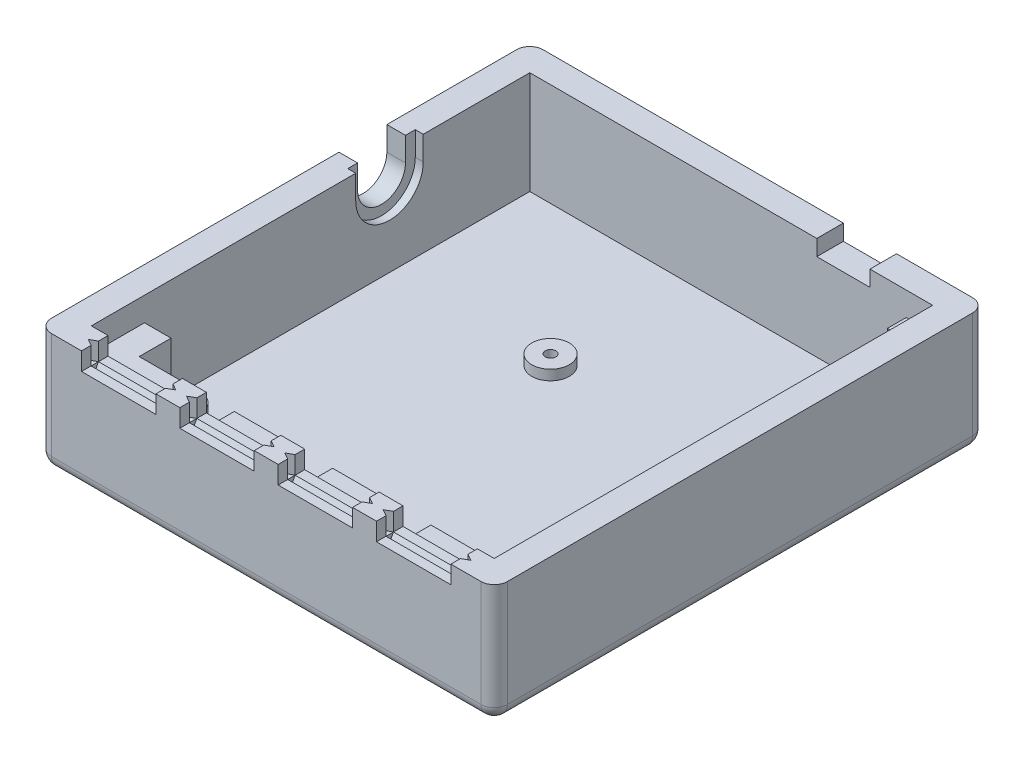
from build123d import *

# Parameters (mm, degrees)
SKETCH1_W           = 85.8
SKETCH1_H           = 92.5
BOSS_EXTRUDE1_DEPTH = 14.859
SKETCH2_W           = 85.8
SKETCH2_H           = 92.5
SKETCH2_R           = 1
BOSS_EXTRUDE2_DEPTH = 3.175
SKETCH4_W           = 85.8
SKETCH4_H           = 92.5
SKETCH4_W_2         = 75.8
SKETCH4_H_2         = 82.5
BOSS_EXTRUDE3_DEPTH = 4.5
CUT_EXTRUDE1_DEPTH  = 121.663419813
SKETCH5_W           = 14
SKETCH5_H           = 8
CUT_EXTRUDE2_DEPTH  = 121.663419813
SKETCH6_W           = 10
SKETCH6_H           = 6
CUT_EXTRUDE3_DEPTH  = 121.663419813
BOSS_EXTRUDE4_START = 1.9
SKETCH7_R           = 3.54
SKETCH7_R_2         = 1
BOSS_EXTRUDE4_DEPTH = 1.9
FILLET1_R           = 2.5
FILLET2_R           = 2.5
FILLET3_R           = 2.5
FILLET4_R           = 2.5
FILLET5_R           = 2.5
CUT_EXTRUDE4_DEPTH  = 1.5
CUT_EXTRUDE5_DEPTH  = 4
CUT_EXTRUDE7_DEPTH  = 73.9
SKETCH12_W          = 4.501
SKETCH12_H          = 4
BOSS_EXTRUDE8_DEPTH = 5


with BuildPart() as part:
    # Sketch1 → Boss-Extrude1 (new body)
    with BuildSketch(Plane(origin=(0, 0, 0), x_dir=(1, 0, 0), z_dir=(0, 1, 0))):
        with Locations((37.9, 41.25)):
            Rectangle(SKETCH1_W, SKETCH1_H)
        Polygon((5, 4), (5, 10), (0, 10), (0, 82.5), (70.8, 82.5), (70.8, 79), (75.8, 79), (75.8, 4), (59.9, 4), (59.9, 0), (52.9, 0), (52.9, 4), (41.4, 4), (41.4, 0), (34.4, 0), (34.4, 4), (22.9, 4), (22.9, 0), (15.9, 0), (15.9, 4), align=None, mode=Mode.SUBTRACT)
    extrude(amount=BOSS_EXTRUDE1_DEPTH)

    # Sketch2 → Boss-Extrude2 (add)
    with BuildSketch(Plane(origin=(0, 0, 0), x_dir=(1, 0, 0), z_dir=(0, 1, 0))):
        with Locations((37.9, 41.25)):
            Rectangle(SKETCH2_W, SKETCH2_H)
        with Locations(Location((3.5, 13.5, 0), (0, 0, 270))):
            Circle(SKETCH2_R, mode=Mode.SUBTRACT)
        with Locations(Location((19.4, 3.5, 0), (0, 0, 270))):
            Circle(SKETCH2_R, mode=Mode.SUBTRACT)
        with Locations(Location((37.9, 3.5, 0), (0, 0, 270))):
            Circle(SKETCH2_R, mode=Mode.SUBTRACT)
        with Locations(Location((56.4, 3.5, 0), (0, 0, 270))):
            Circle(SKETCH2_R, mode=Mode.SUBTRACT)
        with Locations(Location((30.3, 56.1, 0), (0, 0, 270))):
            Circle(SKETCH2_R, mode=Mode.SUBTRACT)
        with Locations(Location((71.8, 75.5, 0), (0, 0, 270))):
            Circle(SKETCH2_R, mode=Mode.SUBTRACT)
    extrude(amount=-BOSS_EXTRUDE2_DEPTH)

    # Sketch4 → Boss-Extrude3 (add)
    with BuildSketch(Plane(origin=(0, 14.859, 0), x_dir=(1, 0, 0), z_dir=(0, 1, 0))):
        with Locations((37.9, 41.25)):
            Rectangle(SKETCH4_W, SKETCH4_H)
        with Locations((37.9, 41.25)):
            Rectangle(SKETCH4_W_2, SKETCH4_H_2, mode=Mode.SUBTRACT)
    extrude(amount=BOSS_EXTRUDE3_DEPTH)

    # Sketch3 → Cut-Extrude1 (cut, through all)
    with BuildSketch(Plane(origin=(0, 0, 0), x_dir=(0, 0, -1), z_dir=(1, 0, 0))):
        with BuildLine():
            Line((60.6, 14.859), (60.6, 19.359))
            Line((60.6, 19.359), (51.6, 19.359))
            Line((51.6, 19.359), (51.6, 14.859))
            ThreePointArc((51.6, 14.859), (56.1, 10.359), (60.6, 14.859))
        make_face()
    extrude(amount=-CUT_EXTRUDE1_DEPTH, mode=Mode.SUBTRACT)

    # Sketch5 → Cut-Extrude2 (cut, through all)
    with BuildSketch(Plane.XY):
        with Locations((10.15, 20)):
            Rectangle(SKETCH5_W, SKETCH5_H)
        with Locations((28.65, 20)):
            Rectangle(SKETCH5_W, SKETCH5_H)
        with Locations((47.15, 20)):
            Rectangle(SKETCH5_W, SKETCH5_H)
        with Locations((65.65, 20)):
            Rectangle(SKETCH5_W, SKETCH5_H)
    extrude(amount=CUT_EXTRUDE2_DEPTH, mode=Mode.SUBTRACT)

    # Sketch6 → Cut-Extrude3 (cut, through all)
    with BuildSketch(Plane.XY):
        with Locations((59, 19.383)):
            Rectangle(SKETCH6_W, SKETCH6_H)
    extrude(amount=-CUT_EXTRUDE3_DEPTH, mode=Mode.SUBTRACT)

    # Sketch7 → Boss-Extrude4 (add)
    # profile 1 of 6: a face of its own
    with BuildSketch(Plane(origin=(0, 0, 0), x_dir=(1, 0, 0), z_dir=(0, 1, 0)).offset(BOSS_EXTRUDE4_START)):
        with Locations(Location((30.3, 56.1, 0), (0, 0, 90))):
            Circle(SKETCH7_R)
        with Locations(Location((30.3, 56.1, 0), (0, 0, 270))):
            Circle(SKETCH7_R_2, mode=Mode.SUBTRACT)
    # profile 2 of 6: a face of its own
    with BuildSketch(Plane(origin=(0, 0, 0), x_dir=(1, 0, 0), z_dir=(0, 1, 0)).offset(BOSS_EXTRUDE4_START)):
        with BuildLine():
            Line((0, 13.5), (0, 10))
            Line((0, 10), (3.5, 10))
            ThreePointArc((3.5, 10), (5.974873734, 15.974873734), (0, 13.5))
        make_face()
        with Locations(Location((3.5, 13.5, 0), (0, 0, 270))):
            Circle(SKETCH7_R_2, mode=Mode.SUBTRACT)
    # profile 3 of 6: a face of its own
    with BuildSketch(Plane(origin=(0, 0, 0), x_dir=(1, 0, 0), z_dir=(0, 1, 0)).offset(BOSS_EXTRUDE4_START)):
        with BuildLine():
            Line((15.9, 3.5), (15.9, 0))
            Line((15.9, 0), (22.9, 0))
            Line((22.9, 0), (22.9, 3.5))
            ThreePointArc((22.9, 3.5), (19.4, 7), (15.9, 3.5))
        make_face()
        with Locations(Location((19.4, 3.5, 0), (0, 0, 270))):
            Circle(SKETCH7_R_2, mode=Mode.SUBTRACT)
    # profile 4 of 6: a face of its own
    with BuildSketch(Plane(origin=(0, 0, 0), x_dir=(1, 0, 0), z_dir=(0, 1, 0)).offset(BOSS_EXTRUDE4_START)):
        with BuildLine():
            Line((34.4, 3.5), (34.4, 0))
            Line((34.4, 0), (41.4, 0))
            Line((41.4, 0), (41.4, 3.5))
            ThreePointArc((41.4, 3.5), (37.9, 7), (34.4, 3.5))
        make_face()
        with Locations(Location((37.9, 3.5, 0), (0, 0, 270))):
            Circle(SKETCH7_R_2, mode=Mode.SUBTRACT)
    # profile 5 of 6: a face of its own
    with BuildSketch(Plane(origin=(0, 0, 0), x_dir=(1, 0, 0), z_dir=(0, 1, 0)).offset(BOSS_EXTRUDE4_START)):
        with BuildLine():
            Line((52.9, 3.5), (52.9, 0))
            Line((52.9, 0), (59.9, 0))
            Line((59.9, 0), (59.9, 3.5))
            ThreePointArc((59.9, 3.5), (56.4, 7), (52.9, 3.5))
        make_face()
        with Locations(Location((56.4, 3.5, 0), (0, 0, 270))):
            Circle(SKETCH7_R_2, mode=Mode.SUBTRACT)
    # profile 6 of 6: a face of its own
    with BuildSketch(Plane(origin=(0, 0, 0), x_dir=(1, 0, 0), z_dir=(0, 1, 0)).offset(BOSS_EXTRUDE4_START)):
        with BuildLine():
            Line((75.8, 79), (69.863508327, 79))
            ThreePointArc((69.863508327, 79), (69.768493994, 72.054280431), (75.8, 75.5))
            Line((75.8, 75.5), (75.8, 79))
        make_face()
        with Locations(Location((71.8, 75.5, 0), (0, 0, 270))):
            Circle(SKETCH7_R_2, mode=Mode.SUBTRACT)
    extrude(amount=-BOSS_EXTRUDE4_DEPTH)

    # Fillet1
    fillet1_edges = [part.edges().sort_by_distance(p)[0] for p in [
        (-5, 8.092, 5),
    ]]
    fillet(fillet1_edges, radius=FILLET1_R)

    # Fillet2
    fillet2_edges = [part.edges().sort_by_distance(p)[0] for p in [
        (80.8, 8.092, 5),
    ]]
    fillet(fillet2_edges, radius=FILLET2_R)

    # Fillet3
    fillet3_edges = [part.edges().sort_by_distance(p)[0] for p in [
        (80.8, 8.092, -87.5),
    ]]
    fillet(fillet3_edges, radius=FILLET3_R)

    # Fillet4
    fillet4_edges = [part.edges().sort_by_distance(p)[0] for p in [
        (-5, 8.092, -87.5),
    ]]
    fillet(fillet4_edges, radius=FILLET4_R)

    # Fillet5
    fillet5_edges = [part.edges().sort_by_distance(p)[0] for p in [
        (37.9, -3.175, 5),
        (-4.267766953, -3.175, 4.267766953),
        (80.8, -3.175, -41.25),
        (80.067766953, -3.175, 4.267766953),
        (37.9, -3.175, -87.5),
        (80.067766953, -3.175, -86.767766953),
        (-5, -3.175, -41.25),
        (-4.267766953, -3.175, -86.767766953),
    ]]
    fillet(fillet5_edges, radius=FILLET5_R)

    # Sketch8 → Cut-Extrude4 (cut)
    with BuildSketch(Plane(origin=(0, 0, 0), x_dir=(0, 0, -1), z_dir=(1, 0, 0))):
        with BuildLine():
            Line((62.45, 14.855), (62.45, 21.205))
            Line((62.45, 21.205), (49.75, 21.205))
            Line((49.75, 21.205), (49.75, 14.855))
            ThreePointArc((49.75, 14.855), (56.1, 8.505), (62.45, 14.855))
        make_face()
    extrude(amount=-CUT_EXTRUDE4_DEPTH, mode=Mode.SUBTRACT)

    # Sketch9 → Cut-Extrude5 (cut)
    with BuildSketch(Plane(origin=(0, 19.359, 0), x_dir=(1, 0, 0), z_dir=(0, 1, 0))):
        Polygon((3.15, -1.8), (3.15, -3.2), (1.9, -2.5), align=None)
        Polygon((17.15, -1.8), (17.15, -3.2), (18.4, -2.5), align=None)
        Polygon((21.65, -1.8), (21.65, -3.2), (20.4, -2.5), align=None)
        Polygon((35.65, -1.8), (36.9, -2.5), (35.65, -3.2), align=None)
        Polygon((40.15, -1.8), (38.9, -2.5), (40.15, -3.2), align=None)
        Polygon((54.15, -1.8), (54.15, -3.2), (55.4, -2.5), align=None)
        Polygon((58.65, -1.8), (58.65, -3.2), (57.4, -2.5), align=None)
        Polygon((72.65, -1.8), (72.65, -3.2), (73.9, -2.5), align=None)
    extrude(amount=-CUT_EXTRUDE5_DEPTH, mode=Mode.SUBTRACT)

    # Sketch10 → Cut-Extrude7 (cut)
    with BuildSketch(Plane(origin=(0, 0, 0), x_dir=(0, 0, -1), z_dir=(1, 0, 0))):
        Polygon((-3.2, 16), (-1.8, 16), (-2.5, 14.7), align=None)
    extrude(amount=CUT_EXTRUDE7_DEPTH, mode=Mode.SUBTRACT)

    # Sketch12 → Boss-Extrude8 (add)
    with BuildSketch(Plane.XY):
        with Locations((0.8995, 14)):
            Rectangle(SKETCH12_W, SKETCH12_H)
        with Locations((19.3995, 14)):
            Rectangle(SKETCH12_W, SKETCH12_H)
        with Locations((37.8995, 14)):
            Rectangle(SKETCH12_W, SKETCH12_H)
        with Locations((56.3995, 14)):
            Rectangle(SKETCH12_W, SKETCH12_H)
        with Locations((74.9005, 14)):
            Rectangle(SKETCH12_W, SKETCH12_H)
    extrude(amount=BOSS_EXTRUDE8_DEPTH)


solid = part.part
